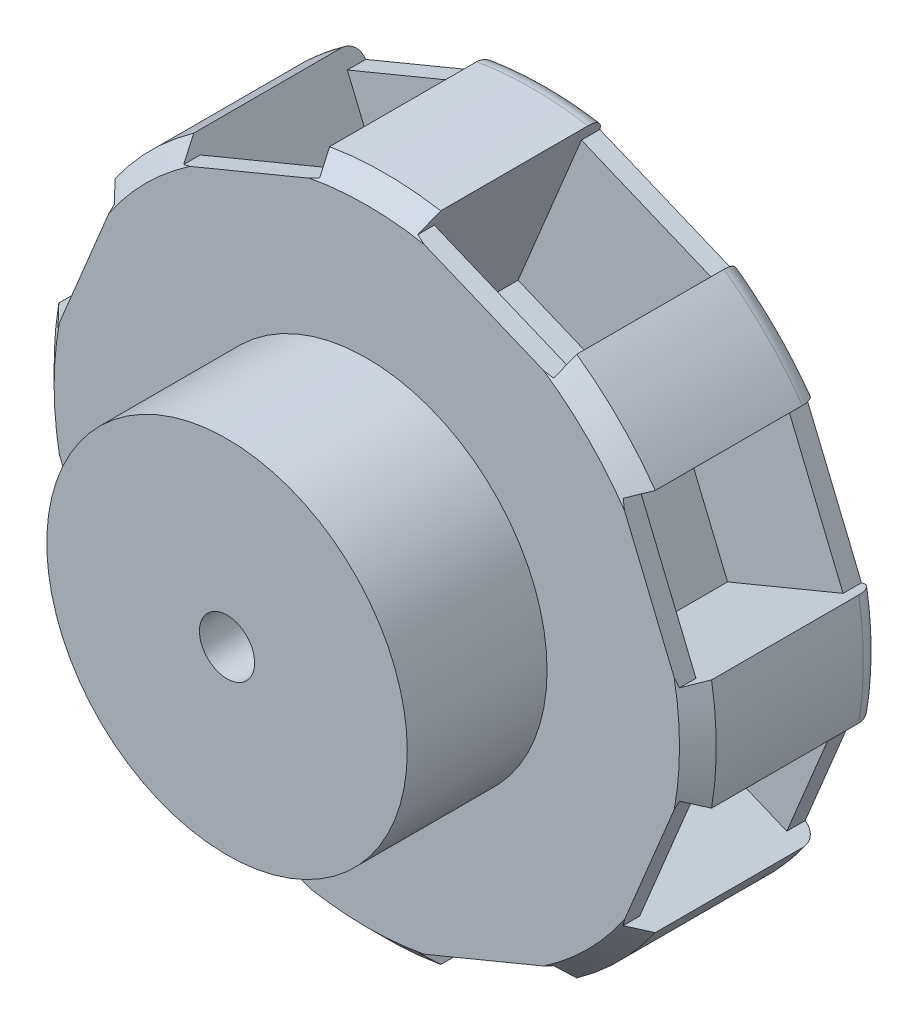
from build123d import *

# Parameters (mm, degrees)
CROQUIS1_R              = 90
CROQUIS1_R_2            = 7.5
SALIENTE_EXTRUIR1_DEPTH = 50
CORTAR_EXTRUIR1_START   = -50
CORTAR_EXTRUIR1_DEPTH   = 50
CROQUIS3_W              = 40
CROQUIS3_H              = 40
CORTAR_EXTRUIR2_DEPTH   = 34
CROQUIS4_W              = 40
CROQUIS4_H              = 40
CORTAR_EXTRUIR3_DEPTH   = 45
CROQUIS5_W              = 40
CROQUIS5_H              = 40
CORTAR_EXTRUIR4_DEPTH   = 34
CROQUIS6_W              = 40
CROQUIS6_H              = 40
CORTAR_EXTRUIR5_DEPTH   = 45
CROQUIS7_W              = 40
CROQUIS7_H              = 40
CORTAR_EXTRUIR6_DEPTH   = 34
CROQUIS9_W              = 40
CROQUIS9_H              = 40
CORTAR_EXTRUIR7_DEPTH   = 45
CROQUIS10_W             = 40
CROQUIS10_H             = 40
CORTAR_EXTRUIR8_DEPTH   = 34
CROQUIS11_W             = 40
CROQUIS11_H             = 40
CORTAR_EXTRUIR9_DEPTH   = 45
CROQUIS15_R             = 49
CROQUIS15_R_2           = 7.5
SALIENTE_EXTRUIR3_DEPTH = 38
REDONDEO4_R             = 5
CHAFL_N1_SIZE           = 5


with BuildPart() as part:
    # Croquis1 → Saliente-Extruir1 (new body)
    with BuildSketch(Plane.XY):
        with Locations((-48.410379245, 39.568962676)):
            Circle(CROQUIS1_R)
        with Locations((-48.410379245, 39.568962676)):
            Circle(CROQUIS1_R_2, mode=Mode.SUBTRACT)
    extrude(amount=SALIENTE_EXTRUIR1_DEPTH)

    # Croquis2 → Cortar-Extruir1 (cut)
    with BuildSketch(Plane.XY.offset(50).offset(CORTAR_EXTRUIR1_START)):
        with BuildLine():
            Line((-137.134407542, 54.670181264), (-132.884430482, 52.909783126))
            Line((-132.884430482, 52.909783126), (-117.577093187, 89.864964426))
            Line((-117.577093187, 89.864964426), (-121.827705716, 91.625625784))
            ThreePointArc((-121.827705716, 91.625625784), (-131.560129403, 74.00904178), (-137.134407542, 54.670181264))
        make_face()
        with BuildLine():
            Line((-100.46956724, 112.984498806), (-98.709169102, 108.734521747))
            Line((-98.709169102, 108.734521747), (-61.753987802, 124.041859041))
            Line((-61.753987802, 124.041859041), (-63.51464916, 128.29247157))
            ThreePointArc((-63.51464916, 128.29247157), (-82.853317957, 122.717528346), (-100.46956724, 112.984498806))
        make_face()
        with BuildLine():
            Line((-35.069558796, 124.043013913), (1.885622505, 108.735676618))
            Line((1.885622505, 108.735676618), (3.646283863, 112.986289147))
            ThreePointArc((3.646283863, 112.986289147), (-13.970300142, 122.718712835), (-33.309160658, 128.292990973))
            Line((-33.309160658, 128.292990973), (-35.069558796, 124.043013913))
        make_face()
        with BuildLine():
            Line((20.756334697, 89.864964426), (36.063671992, 52.909783126))
            Line((36.063671992, 52.909783126), (40.313649051, 54.670181264))
            ThreePointArc((40.313649051, 54.670181264), (34.739370913, 74.00904178), (25.006947226, 91.625625784))
            Line((25.006947226, 91.625625784), (20.756334697, 89.864964426))
        make_face()
        with BuildLine():
            Line((40.313129648, 24.464692762), (36.06251712, 26.22535412))
            Line((36.06251712, 26.22535412), (20.755179825, -10.729827181))
            Line((20.755179825, -10.729827181), (25.005156885, -12.490225319))
            ThreePointArc((25.005156885, -12.490225319), (34.738186424, 5.126023964), (40.313129648, 24.464692762))
        make_face()
        with BuildLine():
            Line((-100.467042353, -33.848363794), (-98.706380995, -29.597751266))
            Line((-98.706380995, -29.597751266), (-61.751199695, -44.90508856))
            Line((-61.751199695, -44.90508856), (-63.511597833, -49.15506562))
            ThreePointArc((-63.511597833, -49.15506562), (-82.850458348, -43.580787482), (-100.467042353, -33.848363794))
        make_face()
        with BuildLine():
            Line((-35.069558796, -44.90508856), (1.885622505, -29.597751266))
            Line((1.885622505, -29.597751266), (3.646283863, -33.848363794))
            ThreePointArc((3.646283863, -33.848363794), (-13.970300142, -43.580787482), (-33.309160658, -49.15506562))
            Line((-33.309160658, -49.15506562), (-35.069558796, -44.90508856))
        make_face()
        with BuildLine():
            Line((-132.88327561, 26.22535412), (-137.133888138, 24.464692762))
            ThreePointArc((-137.133888138, 24.464692762), (-131.558944914, 5.126023964), (-121.825915375, -12.490225319))
            Line((-121.825915375, -12.490225319), (-117.575938315, -10.729827181))
            Line((-117.575938315, -10.729827181), (-132.88327561, 26.22535412))
        make_face()
    extrude(amount=CORTAR_EXTRUIR1_DEPTH, mode=Mode.SUBTRACT)

    # Croquis3 → Cortar-Extruir2 (cut)
    with BuildSketch(Plane(origin=(-104.150907581, -43.140718454, 0), x_dir=(0, 0, 1), z_dir=(-0.9238795325112844, -0.3826834323650955, 0))):
        with Locations((25, 55.081295918)):
            Rectangle(CROQUIS3_W, CROQUIS3_H)
    extrude(amount=-CORTAR_EXTRUIR2_DEPTH, mode=Mode.SUBTRACT)

    # Croquis4 → Cortar-Extruir3 (cut)
    with BuildSketch(Plane(origin=(-24.919600137, -60.161236621, 0), x_dir=(0.9238795325112896, -0.38268343236508306, 0), z_dir=(-0.38268343236508306, -0.9238795325112896, 0))):
        with Locations((-59.866236085, 25)):
            Rectangle(CROQUIS4_W, CROQUIS4_H)
    extrude(amount=-CORTAR_EXTRUIR3_DEPTH, mode=Mode.SUBTRACT)

    # Croquis5 → Cortar-Extruir4 (cut)
    with BuildSketch(Plane(origin=(10.740528336, -25.929929177, 0), x_dir=(0.9238795325112853, 0.3826834323650933, 0), z_dir=(0.38268343236509333, -0.9238795325112854, 0))):
        with Locations((-29.584481006, 25)):
            Rectangle(CROQUIS5_W, CROQUIS5_H)
    extrude(amount=-CORTAR_EXTRUIR4_DEPTH, mode=Mode.SUBTRACT)

    # Croquis6 → Cortar-Extruir5 (cut)
    with BuildSketch(Plane(origin=(21.509220892, -8.90941101, 0), x_dir=(0, 0, -1), z_dir=(0.9238795325112878, -0.3826834323650873, 0))):
        with Locations((-25, 18.029595735)):
            Rectangle(CROQUIS6_W, CROQUIS6_H)
    extrude(amount=-CORTAR_EXTRUIR5_DEPTH, mode=Mode.SUBTRACT)

    # Croquis7 → Cortar-Extruir6 (cut)
    with BuildSketch(Plane(origin=(49.488702725, 20.498891853, 0), x_dir=(0, 0, -1), z_dir=(0.9238795325112854, 0.3826834323650933, 0))):
        with Locations((-25, 55.081295918)):
            Rectangle(CROQUIS7_W, CROQUIS7_H)
    extrude(amount=-CORTAR_EXTRUIR6_DEPTH, mode=Mode.SUBTRACT)

    # Croquis9 → Cortar-Extruir7 (cut)
    with BuildSketch(Plane(origin=(38.720010169, 93.478373686, 0), x_dir=(0.9238795325112876, -0.38268343236508795, 0), z_dir=(0.38268343236508795, 0.9238795325112876, 0))):
        with Locations((-59.869253911, -25)):
            Rectangle(CROQUIS9_W, CROQUIS9_H)
    extrude(amount=-CORTAR_EXTRUIR7_DEPTH, mode=Mode.SUBTRACT)

    # Croquis10 → Cortar-Extruir8 (cut)
    with BuildSketch(Plane(origin=(-52.89908197, 127.70968113, 0), x_dir=(0.9238795325112874, 0.38268343236508845, 0), z_dir=(-0.38268343236508845, 0.9238795325112874, 0))):
        with Locations((-29.584481006, -25)):
            Rectangle(CROQUIS10_W, CROQUIS10_H)
    extrude(amount=-CORTAR_EXTRUIR8_DEPTH, mode=Mode.SUBTRACT)

    # Croquis11 → Cortar-Extruir9 (cut)
    with BuildSketch(Plane(origin=(-132.130389414, 54.730199297, 0), x_dir=(0, 0, 1), z_dir=(-0.9238795325112876, 0.3826834323650877, 0))):
        with Locations((25, 18.029595735)):
            Rectangle(CROQUIS11_W, CROQUIS11_H)
    extrude(amount=-CORTAR_EXTRUIR9_DEPTH, mode=Mode.SUBTRACT)

    # Croquis15 → Saliente-Extruir3 (add)
    with BuildSketch(Plane.XY.offset(50)):
        with Locations((-48.410379245, 39.568962676)):
            Circle(CROQUIS15_R)
        with Locations((-48.410379245, 39.568962676)):
            Circle(CROQUIS15_R_2, mode=Mode.SUBTRACT)
    extrude(amount=SALIENTE_EXTRUIR3_DEPTH)

    # Redondeo4
    redondeo4_edges = [part.edges().sort_by_distance(p)[0] for p in [
        (15.228136727, -24.071741946, 0),
        (41.589620742, 39.567415067, 0),
        (15.229231062, 103.208572983, 0),
        (-48.411926854, 129.568962663, 0),
        (-112.051083867, 103.207478649, 0),
        (-138.410379232, 39.567415067, 0),
        (-112.048895218, -24.071741946, 0),
        (-48.410379245, -50.431037324, 0),
    ]]
    fillet(redondeo4_edges, radius=REDONDEO4_R)

    # Chaflán1
    chafl_n1_edges = [part.edges().sort_by_distance(p)[0] for p in [
        (41.589620742, 39.567415067, 50),
        (15.229231062, 103.208572983, 50),
        (-48.411926854, 129.568962663, 50),
        (-112.051083867, 103.207478649, 50),
        (-138.410379232, 39.567415067, 50),
        (-112.048895218, -24.071741946, 50),
        (-48.410379245, -50.431037324, 50),
        (15.228136727, -24.071741946, 50),
    ]]
    chamfer(chafl_n1_edges, length=CHAFL_N1_SIZE)


solid = part.part
